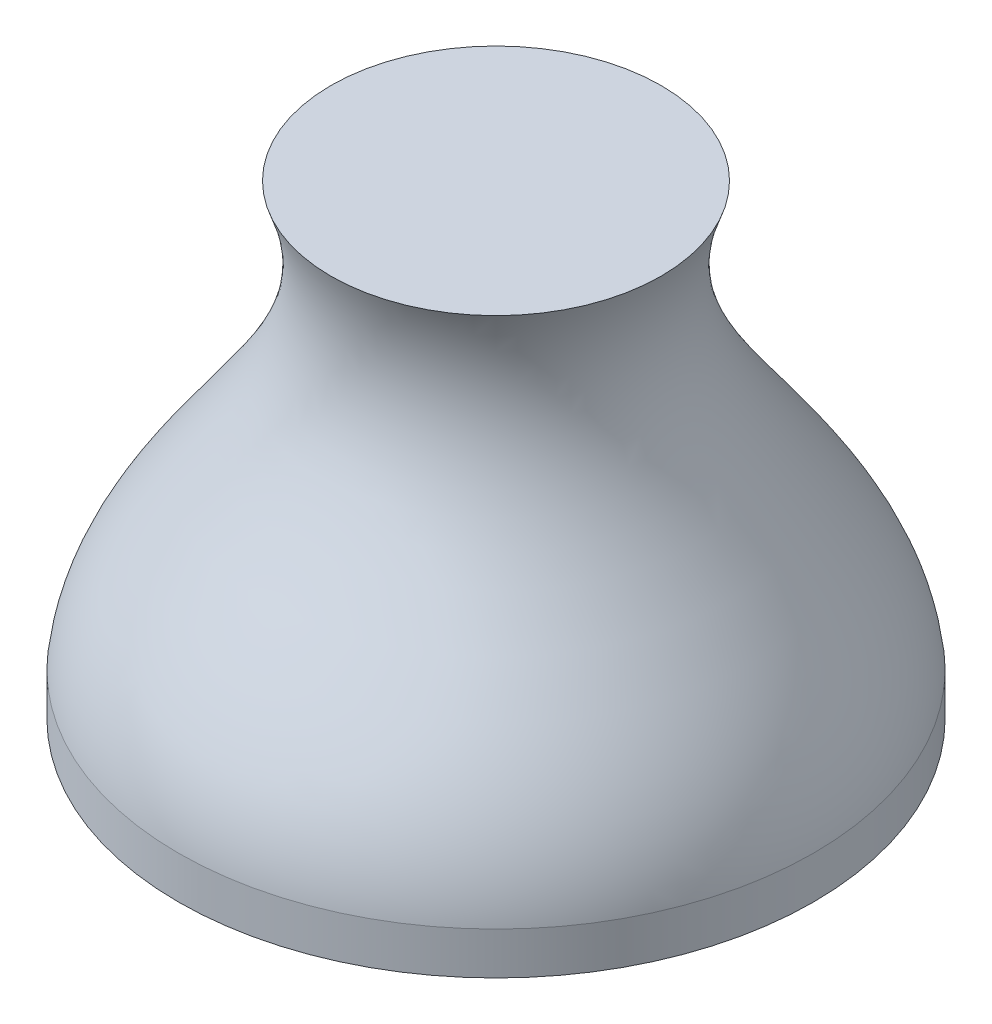
from build123d import *

# Parameters (mm, degrees)
SKETCH2_R           = 15
BOSS_EXTRUDE1_DEPTH = 2


with BuildPart() as part:
    # Sketch1 → Revolve1 (revolve)
    with BuildSketch(Plane.XY):
        with BuildLine():
            Line((0, 0), (0, 20))
            Line((0, 20), (7.799466787, 20))
            add(Edge.make_bspline(
                [(7.799466787, 20), (4.502561706, 11.692536174), (14.14327911, 7.420303534), (15, 0)],
                knots=[0, 0, 0, 0, 1, 1, 1, 1], degree=3))
            Line((15, 0), (0, 0))
        make_face()
    revolve(axis=Axis((0, 0, 0), (0, 1, 0)))

    # Sketch2 → Boss-Extrude1 (add)
    with BuildSketch(Plane.XZ):
        with Locations(Location((0, 0, 0), (0, 0, 270))):
            Circle(SKETCH2_R)
    extrude(amount=BOSS_EXTRUDE1_DEPTH)


solid = part.part
